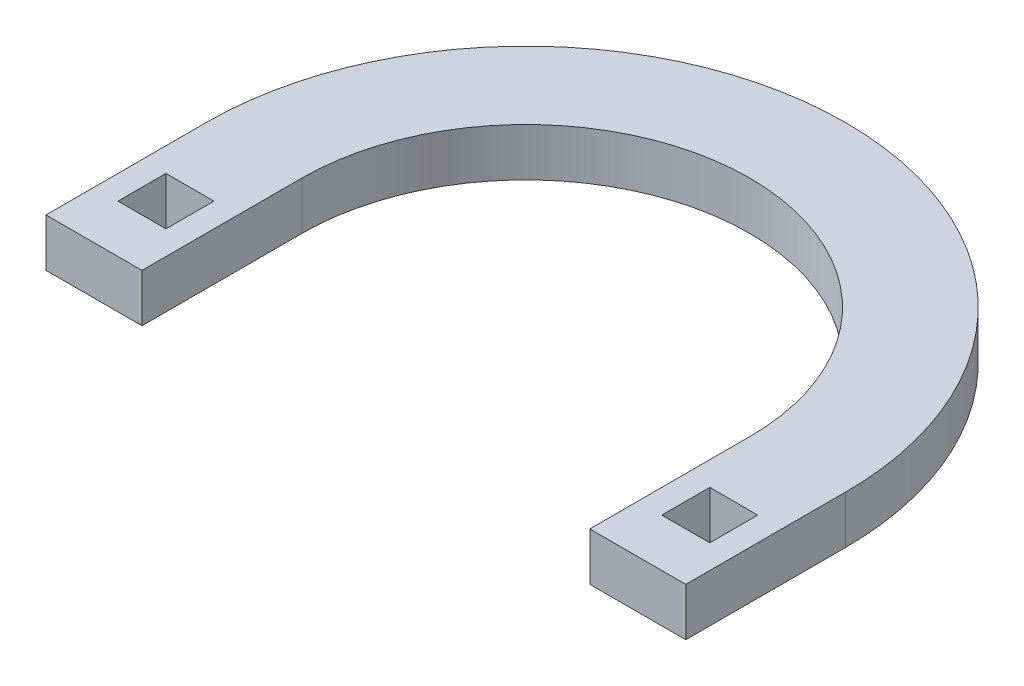
from build123d import *

# Parameters (mm, degrees)
BOSS_EXTRUDE1_DEPTH = 3
SKETCH2_W           = 3
SKETCH2_H           = 3
CUT_EXTRUDE1_DEPTH  = 70.726054689


with BuildPart() as part:
    # Sketch1 → Boss-Extrude1 (new body)
    with BuildSketch(Plane(origin=(0, 0, 0), x_dir=(1, 0, 0), z_dir=(0, 1, 0))):
        with BuildLine():
            Line((-20, 0), (-20, -10))
            Line((-20, -10), (-14, -10))
            Line((-14, -10), (-14, 0))
            ThreePointArc((-14, 0), (0, 14), (14, 0))
            Line((14, 0), (14, -10))
            Line((14, -10), (20, -10))
            Line((20, -10), (20, 0))
            ThreePointArc((20, 0), (0, 20), (-20, 0))
        make_face()
    extrude(amount=BOSS_EXTRUDE1_DEPTH)

    # Sketch2 → Cut-Extrude1 (cut, through all)
    with BuildSketch(Plane(origin=(-39.0910666, 6, -26.523534202), x_dir=(1, 0, 0), z_dir=(0, 1, 0))):
        with Locations((22.0910666, -32.023534202)):
            Rectangle(SKETCH2_W, SKETCH2_H)
        with Locations((56.0910666, -32.023534202)):
            Rectangle(SKETCH2_W, SKETCH2_H)
    extrude(amount=-CUT_EXTRUDE1_DEPTH, mode=Mode.SUBTRACT)


solid = part.part
